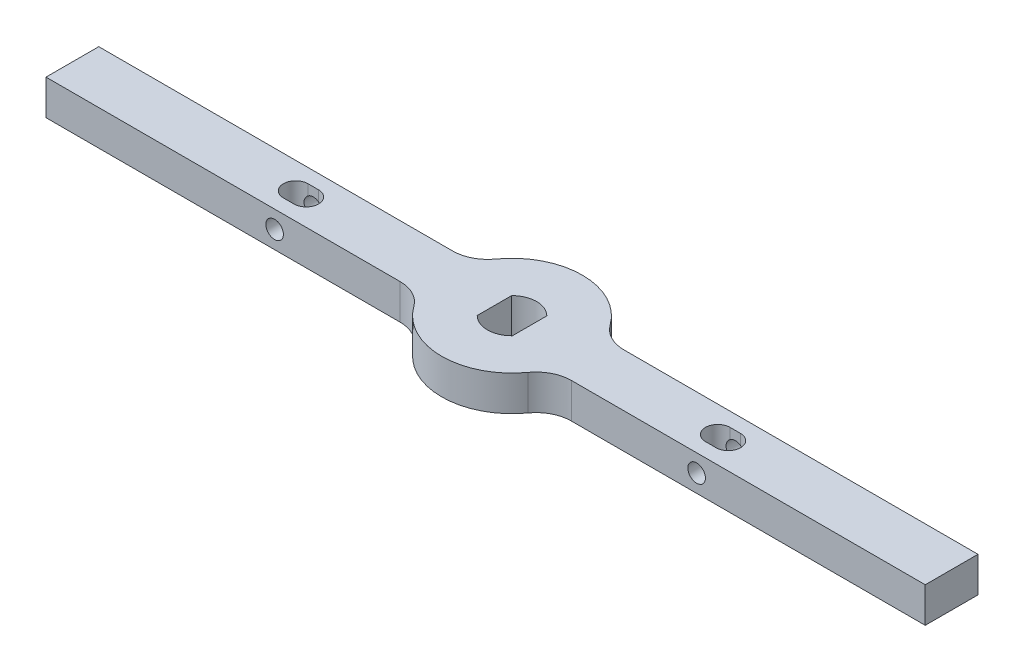
from build123d import *

# Parameters (mm, degrees)
SKETCH1_R           = 20
SKETCH1_W           = 250
SKETCH1_H           = 15
BOSS_EXTRUDE1_DEPTH = 10
CUT_EXTRUDE1_DEPTH  = 127.984250992
FILLET1_R           = 10
CUT_EXTRUDE2_DEPTH  = 127.984250992
SKETCH6_R           = 2.5
CUT_EXTRUDE3_DEPTH  = 129.379320765
SKETCH7_R           = 2.5
CUT_EXTRUDE4_DEPTH  = 129.379320772


with BuildPart() as part:
    # Sketch1 → Boss-Extrude1 (new body)
    with BuildSketch(Plane(origin=(0, 0, 0), x_dir=(1, 0, 0), z_dir=(0, 1, 0))):
        Circle(SKETCH1_R)
        Rectangle(SKETCH1_W, SKETCH1_H)
    extrude(amount=BOSS_EXTRUDE1_DEPTH)

    # Sketch2 → Cut-Extrude1 (cut, through all)
    with BuildSketch(Plane(origin=(0, 10, 0), x_dir=(1, 0, 0), z_dir=(0, 1, 0))):
        with BuildLine():
            Line((-5, 4.898979486), (-5, -4.898979486))
            ThreePointArc((-5, -4.898979486), (0, -7), (5, -4.898979486))
            Line((5, -4.898979486), (5, 4.898979486))
            ThreePointArc((5, 4.898979486), (0, 7), (-5, 4.898979486))
        make_face()
    extrude(amount=-CUT_EXTRUDE1_DEPTH, mode=Mode.SUBTRACT)

    # Fillet1
    fillet1_edges = [part.edges().sort_by_distance(p)[0] for p in [
        (-18.540496218, 5, -7.5),
        (18.540496218, 5, -7.5),
        (-18.540496218, 5, 7.5),
        (18.540496218, 5, 7.5),
    ]]
    fillet(fillet1_edges, radius=FILLET1_R)

    # Sketch4 → Cut-Extrude2 (cut, through all)
    with BuildSketch(Plane(origin=(0, 10, 0), x_dir=(1, 0, 0), z_dir=(0, 1, 0))):
        with BuildLine():
            Line((-61.5, 3.5), (-58.5, 3.5))
            ThreePointArc((-58.5, 3.5), (-55, 0), (-58.5, -3.5))
            Line((-58.5, -3.5), (-61.5, -3.5))
            ThreePointArc((-61.5, -3.5), (-65, 0), (-61.5, 3.5))
        make_face()
        with BuildLine():
            Line((58.5, 3.5), (61.5, 3.5))
            ThreePointArc((61.5, 3.5), (65, 0), (61.5, -3.5))
            Line((61.5, -3.5), (58.5, -3.5))
            ThreePointArc((58.5, -3.5), (55, 0), (58.5, 3.5))
        make_face()
    extrude(amount=-CUT_EXTRUDE2_DEPTH, mode=Mode.SUBTRACT)

    # Sketch6 → Cut-Extrude3 (cut, through all)
    with BuildSketch(Plane.XY.offset(7.5)):
        with Locations((-60, 5)):
            Circle(SKETCH6_R)
    extrude(amount=-CUT_EXTRUDE3_DEPTH, mode=Mode.SUBTRACT)

    # Sketch7 → Cut-Extrude4 (cut, through all)
    with BuildSketch(Plane.XY.offset(7.5)):
        with Locations((60, 5)):
            Circle(SKETCH7_R)
    extrude(amount=-CUT_EXTRUDE4_DEPTH, mode=Mode.SUBTRACT)


solid = part.part
